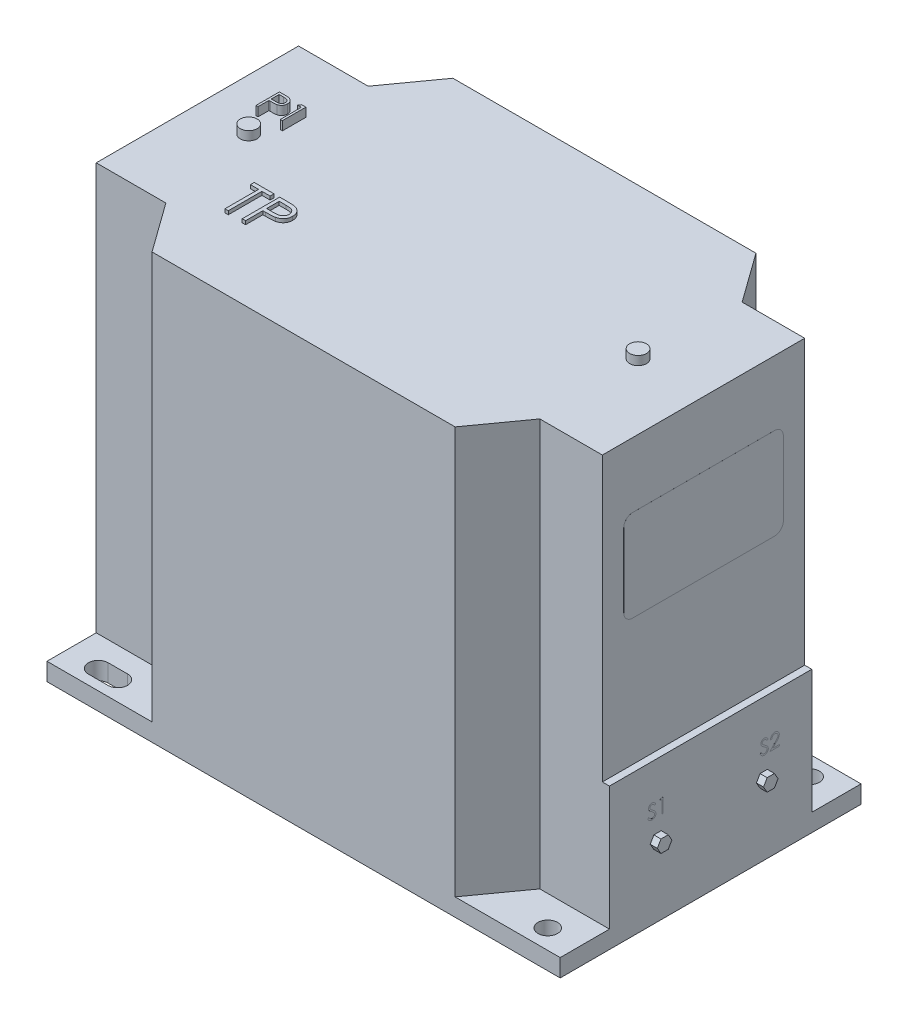
from build123d import *

# Parameters (mm, degrees)
CROQUIS1_W               = 290
CROQUIS1_H               = 170
SALIENTE_EXTRUIR1_DEPTH  = 240
CROQUIS2_R               = 5.5
CORTAR_EXTRUIR1_DEPTH    = 230
CROQUIS3_R               = 5.5
CORTAR_EXTRUIR3_DEPTH    = 309
CROQUIS4_W               = 114.318282822
CROQUIS4_H               = 160
CORTAR_EXTRUIR4_DEPTH    = 4
SALIENTE_EXTRUIR2_DEPTH  = 4
SALIENTE_EXTRUIR3_DEPTH  = 4
SALIENTE_EXTRUIR5_DEPTH  = 4
SALIENTE_EXTRUIR6_DEPTH  = 0.01
SALIENTE_EXTRUIR7_DEPTH  = 0.01
SALIENTE_EXTRUIR8_DEPTH  = 0.01
CROQUIS11_R              = 4.75
SALIENTE_EXTRUIR9_DEPTH  = 5
CROQUIS12_W              = 19.477537379
CROQUIS12_H              = 1.947753737
CROQUIS12_W_2            = 14.751875946
CROQUIS12_H_2            = 1.829107359
CROQUIS12_W_3            = 5.2253802
CROQUIS12_H_3            = 1.246064316
CROQUIS12_W_4            = 1.909821467
CROQUIS12_H_4            = 22.488415391
CROQUIS12_W_5            = 10.038203482
CROQUIS12_H_5            = 1.679080429
SALIENTE_EXTRUIR10_DEPTH = 0.1
SALIENTE_EXTRUIR11_DEPTH = 2


with BuildPart() as part:
    # Croquis1 → Saliente-Extruir1 (new body)
    with BuildSketch(Plane(origin=(0, 0, 0), x_dir=(1, 0, 0), z_dir=(0, 1, 0))):
        Rectangle(CROQUIS1_W, CROQUIS1_H)
    extrude(amount=SALIENTE_EXTRUIR1_DEPTH)

    # Croquis2 → Cortar-Extruir1 (cut)
    # profile 1 of 4: a face of its own
    with BuildSketch(Plane(origin=(0, 240, 0), x_dir=(1, 0, 0), z_dir=(0, 1, 0))):
        Polygon((-105.653068474, -57.159141411), (-145, -57.159141411), (-145, -85), (-85.626113794, -85), align=None)
        with BuildLine():
            Line((-116, -79.5), (-127, -79.5))
            ThreePointArc((-127, -79.5), (-132.5, -74), (-127, -68.5))
            Line((-127, -68.5), (-116, -68.5))
            ThreePointArc((-116, -68.5), (-110.5, -74), (-116, -79.5))
        make_face(mode=Mode.SUBTRACT)
    # profile 2 of 4: a face of its own
    with BuildSketch(Plane(origin=(0, 240, 0), x_dir=(1, 0, 0), z_dir=(0, 1, 0))):
        Polygon((-145, 85), (-145, 57.159141411), (-105.653068474, 57.159141411), (-85.626113794, 85), align=None)
        with BuildLine():
            ThreePointArc((-127, 68.5), (-132.5, 74), (-127, 79.5))
            Line((-127, 79.5), (-116, 79.5))
            ThreePointArc((-116, 79.5), (-110.5, 74), (-116, 68.5))
            Line((-116, 68.5), (-127, 68.5))
        make_face(mode=Mode.SUBTRACT)
    # profile 3 of 4: a face of its own
    with BuildSketch(Plane(origin=(0, 240, 0), x_dir=(1, 0, 0), z_dir=(0, 1, 0))):
        Polygon((145, 85), (85.626113794, 85), (105.653068474, 57.159141411), (145, 57.159141411), align=None)
        with Locations(Location((127, 74, 0), (0, 0, 270))):
            Circle(CROQUIS2_R, mode=Mode.SUBTRACT)
    # profile 4 of 4: a face of its own
    with BuildSketch(Plane(origin=(0, 240, 0), x_dir=(1, 0, 0), z_dir=(0, 1, 0))):
        Polygon((105.653068474, -57.159141411), (85.626113794, -85), (145, -85), (145, -57.159141411), align=None)
        with Locations(Location((127, -74, 0), (0, 0, 270))):
            Circle(CROQUIS2_R, mode=Mode.SUBTRACT)
    extrude(amount=-CORTAR_EXTRUIR1_DEPTH, mode=Mode.SUBTRACT)

    # Croquis3 → Cortar-Extruir3 (cut)
    with BuildSketch(Plane(origin=(0, 240, 0), x_dir=(1, 0, 0), z_dir=(0, 1, 0))):
        with Locations(Location((127, 74, 0), (0, 0, 270))):
            Circle(CROQUIS3_R)
        with Locations(Location((127, -74, 0), (0, 0, 270))):
            Circle(CROQUIS3_R)
        with BuildLine():
            Line((-127, 79.5), (-116, 79.5))
            ThreePointArc((-116, 79.5), (-110.5, 74), (-116, 68.5))
            Line((-116, 68.5), (-127, 68.5))
            ThreePointArc((-127, 68.5), (-132.5, 74), (-127, 79.5))
        make_face()
        with BuildLine():
            Line((-127, -68.426195021), (-116, -68.426195021))
            ThreePointArc((-116, -68.426195021), (-110.426195021, -74), (-116, -79.573804979))
            Line((-116, -79.573804979), (-127, -79.573804979))
            ThreePointArc((-127, -79.573804979), (-132.573804979, -74), (-127, -68.426195021))
        make_face()
    extrude(amount=-CORTAR_EXTRUIR3_DEPTH, mode=Mode.SUBTRACT)

    # Croquis4 → Cortar-Extruir4 (cut)
    with BuildSketch(Plane(origin=(145, 0, 0), x_dir=(0, 0, -1), z_dir=(1, 0, 0))):
        with Locations((0, 160)):
            Rectangle(CROQUIS4_W, CROQUIS4_H)
    extrude(amount=-CORTAR_EXTRUIR4_DEPTH, mode=Mode.SUBTRACT)

    # Croquis5 → Saliente-Extruir2 (add)
    with BuildSketch(Plane.ZY.offset(145)):
        Polygon((43.413866741, 29.419642397), (40.989340839, 33.619044445), (36.140289034, 33.619044445), (33.715763131, 29.419642397), (36.140289034, 25.220240349), (40.989340839, 25.220240349), align=None)
    extrude(amount=SALIENTE_EXTRUIR2_DEPTH)

    # Croquis6 → Saliente-Extruir3 (add)
    with BuildSketch(Plane.ZY.offset(145)):
        Polygon((43.413866741, 74.385865647), (40.989340839, 78.585267695), (36.140289034, 78.585267695), (33.715763131, 74.385865647), (36.140289034, 70.186463599), (40.989340839, 70.186463599), align=None)
    extrude(amount=SALIENTE_EXTRUIR3_DEPTH)

    # Croquis7 → Saliente-Extruir5 (add)
    with BuildSketch(Plane(origin=(145, 0, 0), x_dir=(0, 0, -1), z_dir=(1, 0, 0))):
        Polygon((-27.944874359, 36.440417974), (-32.055125641, 36.440417974), (-34.110251282, 40), (-32.055125641, 43.559582026), (-27.944874359, 43.559582026), (-25.889748718, 40), align=None)
        Polygon((34.110251282, 40), (32.055125641, 43.559582026), (27.944874359, 43.559582026), (25.889748718, 40), (27.944874359, 36.440417974), (32.055125641, 36.440417974), align=None)
    extrude(amount=SALIENTE_EXTRUIR5_DEPTH)

    # Croquis8 → Saliente-Extruir6 (add)
    with BuildSketch(Plane(origin=(145, 0, 0), x_dir=(0, 0, -1), z_dir=(1, 0, 0))):
        with BuildLine():
            Line((-35.585423462, 53.072879107), (-34.914424864, 53.475160256))
            add(Edge.make_bspline(
                [(-34.914424864, 53.475160256), (-34.852017433, 53.370692812), (-34.732447204, 53.17053722), (-34.532986086, 52.900077021), (-34.326309663, 52.67020213), (-34.110887424, 52.482249823), (-33.888034292, 52.33427467), (-33.656295455, 52.229494608), (-33.416451849, 52.164144093), (-33.253225504, 52.156206397), (-33.171736563, 52.15224359)],
                knots=[0, 0, 0, 0, 1.272034388, 2.437168799, 3.508375237, 4.49857839, 5.41946034, 6.295179144, 7.148887113, 8, 8, 8, 8], degree=3))
            add(Edge.make_bspline(
                [(-33.171736563, 52.15224359), (-33.102143147, 52.154181865), (-32.964174037, 52.1580245), (-32.761059665, 52.194947033), (-32.563797363, 52.251670968), (-32.376452774, 52.332907724), (-32.201610934, 52.431193218), (-32.048288607, 52.549906871), (-31.915741172, 52.682817373), (-31.80731693, 52.831095893), (-31.72413185, 52.990565141), (-31.660196266, 53.154249888), (-31.624715474, 53.324721462), (-31.619370694, 53.439498762), (-31.616673462, 53.497420873)],
                knots=[0, 0, 0, 0, 1.095163259, 2.171163733, 3.241058638, 4.321873601, 5.38011039, 6.391990106, 7.366004449, 8.327778327, 9.272591725, 10.192022065, 11.087607919, 12, 12, 12, 12], degree=3))
            add(Edge.make_bspline(
                [(-31.616673462, 53.497420873), (-31.620016988, 53.563508158), (-31.626813888, 53.697853949), (-31.684262066, 53.896063876), (-31.774634465, 54.092216669), (-31.858006889, 54.213549896), (-31.901291351, 54.276542468)],
                knots=[0, 0, 0, 0, 0.938893495, 1.908633276, 2.914225137, 4, 4, 4, 4], degree=3))
            add(Edge.make_bspline(
                [(-31.901291351, 54.276542468), (-31.936830065, 54.3220058), (-32.01143915, 54.417450379), (-32.139703509, 54.559520824), (-32.290212376, 54.706066167), (-32.45781508, 54.862682242), (-32.648616907, 55.022084924), (-32.856641806, 55.191875483), (-33.087200914, 55.365596917), (-33.248897987, 55.482102556), (-33.332331014, 55.542217548)],
                knots=[0, 0, 0, 0, 0.722233717, 1.516239348, 2.393582979, 3.351407094, 4.387010283, 5.505090956, 6.712668013, 8, 8, 8, 8], degree=3))
            add(Edge.make_bspline(
                [(-33.332331014, 55.542217548), (-33.415842577, 55.601700238), (-33.575510326, 55.715426611), (-33.798800325, 55.884210255), (-33.998472589, 56.038524031), (-34.173639645, 56.17982063), (-34.324224445, 56.308119215), (-34.451413609, 56.422187756), (-34.551967122, 56.525111189), (-34.607882457, 56.591879946), (-34.632987064, 56.621857472)],
                knots=[0, 0, 0, 0, 1.452282411, 2.77665338, 3.964542531, 5.026858415, 5.96415736, 6.766646006, 7.446254459, 8, 8, 8, 8], degree=3))
            add(Edge.make_bspline(
                [(-34.632987064, 56.621857472), (-34.668076586, 56.668577681), (-34.737084841, 56.760459241), (-34.828175603, 56.904070972), (-34.905598347, 57.051080877), (-34.966291493, 57.201883999), (-35.017400418, 57.354363212), (-35.05177644, 57.510508002), (-35.073301572, 57.669617726), (-35.075505899, 57.7766912), (-35.07660936, 57.830290966)],
                knots=[0, 0, 0, 0, 1.068054152, 2.10047183, 3.106115577, 4.101338837, 5.06977816, 6.043150881, 7.020423561, 8, 8, 8, 8], degree=3))
            add(Edge.make_bspline(
                [(-35.07660936, 57.830290966), (-35.073649332, 57.914269204), (-35.067792545, 58.080430706), (-35.018261372, 58.323161339), (-34.940081774, 58.554905535), (-34.830555868, 58.773368971), (-34.689365085, 58.972863249), (-34.525975108, 59.155683121), (-34.331366916, 59.309372584), (-34.117842217, 59.443657074), (-33.884125087, 59.548763012), (-33.639217145, 59.62804952), (-33.382729143, 59.672974087), (-33.209004177, 59.679421071), (-33.120855153, 59.682692308)],
                knots=[0, 0, 0, 0, 1.005424448, 1.989358655, 2.955360095, 3.929531133, 4.905563448, 5.876582895, 6.856512386, 7.866279853, 8.892233794, 9.918561126, 10.94386622, 12, 12, 12, 12], degree=3))
            add(Edge.make_bspline(
                [(-33.120855153, 59.682692308), (-33.027319425, 59.679466164), (-32.841306717, 59.673050394), (-32.567691532, 59.617266706), (-32.304255621, 59.524963397), (-32.092339646, 59.420214119), (-31.92648499, 59.315594659), (-31.8000004, 59.2202997), (-31.671826896, 59.110591864), (-31.540930593, 58.986178931), (-31.409529454, 58.845919335), (-31.275672696, 58.690773666), (-31.139047301, 58.521690048), (-31.051154547, 58.400984484), (-31.006096539, 58.339105068)],
                knots=[0, 0, 0, 0, 1.286793592, 2.559021753, 3.825965368, 5.121522368, 5.803751409, 6.523245864, 7.299691795, 8.125521123, 9.008227632, 9.944561021, 10.946284179, 12, 12, 12, 12], degree=3))
            Line((-31.006096539, 58.339105068), (-31.650064388, 57.850961538))
            add(Edge.make_bspline(
                [(-31.650064388, 57.850961538), (-31.688948913, 57.901055533), (-31.763831417, 57.997524854), (-31.877517932, 58.132624087), (-31.984671116, 58.256032889), (-32.090240773, 58.363223447), (-32.18865133, 58.460065785), (-32.284166765, 58.542978091), (-32.375412526, 58.612772745), (-32.490431234, 58.687257247), (-32.634933916, 58.761090746), (-32.816327418, 58.823568119), (-33.005889149, 58.861112635), (-33.13499742, 58.866076719), (-33.200357356, 58.868589744)],
                knots=[0, 0, 0, 0, 1.181633172, 2.275549214, 3.290209073, 4.226197932, 5.078386478, 5.862611352, 6.581680152, 7.217281963, 8.414376989, 9.595101626, 10.782541182, 12, 12, 12, 12], degree=3))
            add(Edge.make_bspline(
                [(-33.200357356, 58.868589744), (-33.282355184, 58.865841781), (-33.44048027, 58.860542595), (-33.664975984, 58.802666914), (-33.867028278, 58.711540195), (-34.04063856, 58.583825869), (-34.185184919, 58.43251219), (-34.289745513, 58.258388715), (-34.352678921, 58.066114337), (-34.36035852, 57.93198951), (-34.364269616, 57.863681891)],
                knots=[0, 0, 0, 0, 1.14458467, 2.207223713, 3.21896685, 4.227309161, 5.202851033, 6.127160689, 7.046193047, 8, 8, 8, 8], degree=3))
            add(Edge.make_bspline(
                [(-34.364269616, 57.863681891), (-34.363378061, 57.821156216), (-34.361593493, 57.73603533), (-34.33670422, 57.610279426), (-34.304728956, 57.48484121), (-34.254059059, 57.360284638), (-34.184106317, 57.23443136), (-34.092246364, 57.105114205), (-33.97655546, 56.971193366), (-33.887934378, 56.884090929), (-33.841145117, 56.838103466)],
                knots=[0, 0, 0, 0, 0.858281714, 1.717966888, 2.583508476, 3.4729293, 4.427298488, 5.488583878, 6.674047936, 8, 8, 8, 8], degree=3))
            add(Edge.make_bspline(
                [(-33.841145117, 56.838103466), (-33.823770219, 56.822598068), (-33.782491438, 56.785760792), (-33.707026392, 56.725453298), (-33.607370403, 56.651061297), (-33.486125768, 56.559015061), (-33.34105693, 56.452241031), (-33.172147937, 56.332104446), (-32.981281603, 56.19470528), (-32.84584083, 56.098644429), (-32.774225545, 56.047851563)],
                knots=[0, 0, 0, 0, 0.420754252, 0.999615792, 1.744751191, 2.668019286, 3.750313428, 4.999500688, 6.413464383, 8, 8, 8, 8], degree=3))
            add(Edge.make_bspline(
                [(-32.774225545, 56.047851563), (-32.688078921, 55.985164908), (-32.521267921, 55.863780889), (-32.283919481, 55.681409615), (-32.068713881, 55.503047711), (-31.874895544, 55.329834209), (-31.700549698, 55.163082998), (-31.547610582, 55.000787929), (-31.414519842, 54.844111719), (-31.2712384, 54.643241771), (-31.124830488, 54.396541812), (-30.99909707, 54.094285807), (-30.919816532, 53.790854865), (-30.909448988, 53.586913647), (-30.904333719, 53.486290565)],
                knots=[0, 0, 0, 0, 1.163667725, 2.253281268, 3.268753668, 4.215851969, 5.092017293, 5.902905408, 6.650798638, 7.335211899, 8.59617414, 9.77448103, 10.901945474, 12, 12, 12, 12], degree=3))
            add(Edge.make_bspline(
                [(-30.904333719, 53.486290565), (-30.905824014, 53.415128915), (-30.908775664, 53.274187528), (-30.942704879, 53.06723405), (-30.992415549, 52.866231899), (-31.067339276, 52.673665626), (-31.158786438, 52.486012325), (-31.274824179, 52.308194408), (-31.409325535, 52.136276326), (-31.563616395, 51.974842336), (-31.732449066, 51.826646499), (-31.910892445, 51.694818092), (-32.0992386, 51.584898858), (-32.296465782, 51.495203199), (-32.502619296, 51.4250504), (-32.717629806, 51.374221215), (-32.941851733, 51.343025227), (-33.094252825, 51.339787268), (-33.171736563, 51.338141026)],
                knots=[0, 0, 0, 0, 0.983748083, 1.948392443, 2.894712957, 3.844097841, 4.80183111, 5.778335162, 6.776009319, 7.81870978, 8.863265674, 9.881300176, 10.883814829, 11.87499822, 12.874611388, 13.892143829, 14.928324115, 16, 16, 16, 16], degree=3))
            add(Edge.make_bspline(
                [(-33.171736563, 51.338141026), (-33.231688144, 51.339300312), (-33.350836279, 51.341604286), (-33.527070282, 51.361972547), (-33.699743994, 51.390790443), (-33.866690669, 51.436542351), (-34.030061227, 51.492052639), (-34.189145134, 51.560402072), (-34.344019489, 51.642310725), (-34.495552221, 51.735961941), (-34.643357939, 51.844950041), (-34.786050303, 51.971889934), (-34.928311135, 52.113280633), (-35.06594148, 52.272961732), (-35.201725218, 52.448353456), (-35.332985182, 52.641096782), (-35.462438364, 52.850141853), (-35.543662728, 52.997246601), (-35.585423462, 53.072879107)],
                knots=[0, 0, 0, 0, 0.915332311, 1.819136955, 2.706846663, 3.586547465, 4.459518054, 5.340707479, 6.227863349, 7.133153174, 8.059268498, 9.028702269, 10.047606654, 11.120612155, 12.245963614, 13.433783089, 14.680604001, 16, 16, 16, 16], degree=3))
        make_face()
        Polygon((-28.301431575, 59.479166667), (-26.833820898, 59.479166667), (-26.833820898, 51.541666667), (-27.546160642, 51.541666667), (-27.546160642, 58.665064103), (-28.767314488, 58.665064103), align=None)
        with BuildLine():
            Line((27.914576538, 53.072879107), (28.585575136, 53.475160256))
            add(Edge.make_bspline(
                [(28.585575136, 53.475160256), (28.647982567, 53.370692812), (28.767552796, 53.17053722), (28.967013914, 52.900077021), (29.173690337, 52.67020213), (29.389112576, 52.482249823), (29.611965708, 52.33427467), (29.843704545, 52.229494608), (30.083548151, 52.164144093), (30.246774496, 52.156206397), (30.328263437, 52.15224359)],
                knots=[0, 0, 0, 0, 1.272034388, 2.437168799, 3.508375237, 4.49857839, 5.41946034, 6.295179144, 7.148887113, 8, 8, 8, 8], degree=3))
            add(Edge.make_bspline(
                [(30.328263437, 52.15224359), (30.397856853, 52.154181865), (30.535825963, 52.1580245), (30.738940335, 52.194947033), (30.936202637, 52.251670968), (31.123547226, 52.332907724), (31.298389066, 52.431193218), (31.451711393, 52.549906871), (31.584258828, 52.682817373), (31.69268307, 52.831095893), (31.77586815, 52.990565141), (31.839803734, 53.154249888), (31.875284526, 53.324721462), (31.880629306, 53.439498762), (31.883326538, 53.497420873)],
                knots=[0, 0, 0, 0, 1.095163259, 2.171163733, 3.241058638, 4.321873601, 5.38011039, 6.391990106, 7.366004449, 8.327778327, 9.272591725, 10.192022065, 11.087607919, 12, 12, 12, 12], degree=3))
            add(Edge.make_bspline(
                [(31.883326538, 53.497420873), (31.879983012, 53.563508158), (31.873186112, 53.697853949), (31.815737934, 53.896063876), (31.725365535, 54.092216669), (31.641993111, 54.213549896), (31.598708649, 54.276542468)],
                knots=[0, 0, 0, 0, 0.938893495, 1.908633276, 2.914225137, 4, 4, 4, 4], degree=3))
            add(Edge.make_bspline(
                [(31.598708649, 54.276542468), (31.563169935, 54.3220058), (31.48856085, 54.417450379), (31.360296491, 54.559520824), (31.209787624, 54.706066167), (31.04218492, 54.862682242), (30.851383093, 55.022084924), (30.643358194, 55.191875483), (30.412799086, 55.365596917), (30.251102013, 55.482102556), (30.167668986, 55.542217548)],
                knots=[0, 0, 0, 0, 0.722233717, 1.516239348, 2.393582979, 3.351407094, 4.387010283, 5.505090956, 6.712668013, 8, 8, 8, 8], degree=3))
            add(Edge.make_bspline(
                [(30.167668986, 55.542217548), (30.084157423, 55.601700238), (29.924489674, 55.715426611), (29.701199675, 55.884210255), (29.501527411, 56.038524031), (29.326360355, 56.17982063), (29.175775555, 56.308119215), (29.048586391, 56.422187756), (28.948032878, 56.525111189), (28.892117543, 56.591879946), (28.867012936, 56.621857472)],
                knots=[0, 0, 0, 0, 1.452282411, 2.77665338, 3.964542531, 5.026858415, 5.96415736, 6.766646006, 7.446254459, 8, 8, 8, 8], degree=3))
            add(Edge.make_bspline(
                [(28.867012936, 56.621857472), (28.831923414, 56.668577681), (28.762915159, 56.760459241), (28.671824397, 56.904070972), (28.594401653, 57.051080877), (28.533708507, 57.201883999), (28.482599582, 57.354363212), (28.44822356, 57.510508002), (28.426698428, 57.669617726), (28.424494101, 57.7766912), (28.42339064, 57.830290966)],
                knots=[0, 0, 0, 0, 1.068054152, 2.10047183, 3.106115577, 4.101338837, 5.06977816, 6.043150881, 7.020423561, 8, 8, 8, 8], degree=3))
            add(Edge.make_bspline(
                [(28.42339064, 57.830290966), (28.426350668, 57.914269204), (28.432207455, 58.080430706), (28.481738628, 58.323161339), (28.559918226, 58.554905535), (28.669444132, 58.773368971), (28.810634915, 58.972863249), (28.974024892, 59.155683121), (29.168633084, 59.309372584), (29.382157783, 59.443657074), (29.615874913, 59.548763012), (29.860782855, 59.62804952), (30.117270857, 59.672974087), (30.290995823, 59.679421071), (30.379144847, 59.682692308)],
                knots=[0, 0, 0, 0, 1.005424448, 1.989358655, 2.955360095, 3.929531133, 4.905563448, 5.876582895, 6.856512386, 7.866279853, 8.892233794, 9.918561126, 10.94386622, 12, 12, 12, 12], degree=3))
            add(Edge.make_bspline(
                [(30.379144847, 59.682692308), (30.472680575, 59.679466164), (30.658693283, 59.673050394), (30.932308468, 59.617266706), (31.195744379, 59.524963397), (31.407660354, 59.420214119), (31.57351501, 59.315594659), (31.6999996, 59.2202997), (31.828173104, 59.110591864), (31.959069407, 58.986178931), (32.090470546, 58.845919335), (32.224327304, 58.690773666), (32.360952699, 58.521690048), (32.448845453, 58.400984484), (32.493903461, 58.339105068)],
                knots=[0, 0, 0, 0, 1.286793592, 2.559021753, 3.825965368, 5.121522368, 5.803751409, 6.523245864, 7.299691795, 8.125521123, 9.008227632, 9.944561021, 10.946284179, 12, 12, 12, 12], degree=3))
            Line((32.493903461, 58.339105068), (31.849935612, 57.850961538))
            add(Edge.make_bspline(
                [(31.849935612, 57.850961538), (31.811051087, 57.901055533), (31.736168583, 57.997524854), (31.622482068, 58.132624087), (31.515328884, 58.256032889), (31.409759227, 58.363223447), (31.31134867, 58.460065785), (31.215833235, 58.542978091), (31.124587474, 58.612772745), (31.009568766, 58.687257247), (30.865066084, 58.761090746), (30.683672582, 58.823568119), (30.494110851, 58.861112635), (30.36500258, 58.866076719), (30.299642644, 58.868589744)],
                knots=[0, 0, 0, 0, 1.181633172, 2.275549214, 3.290209073, 4.226197932, 5.078386478, 5.862611352, 6.581680152, 7.217281963, 8.414376989, 9.595101626, 10.782541182, 12, 12, 12, 12], degree=3))
            add(Edge.make_bspline(
                [(30.299642644, 58.868589744), (30.217644816, 58.865841781), (30.05951973, 58.860542595), (29.835024016, 58.802666914), (29.632971722, 58.711540195), (29.45936144, 58.583825869), (29.314815081, 58.43251219), (29.210254487, 58.258388715), (29.147321079, 58.066114337), (29.13964148, 57.93198951), (29.135730384, 57.863681891)],
                knots=[0, 0, 0, 0, 1.14458467, 2.207223713, 3.21896685, 4.227309161, 5.202851033, 6.127160689, 7.046193047, 8, 8, 8, 8], degree=3))
            add(Edge.make_bspline(
                [(29.135730384, 57.863681891), (29.136621939, 57.821156216), (29.138406507, 57.73603533), (29.16329578, 57.610279426), (29.195271044, 57.48484121), (29.245940941, 57.360284638), (29.315893683, 57.23443136), (29.407753636, 57.105114205), (29.52344454, 56.971193366), (29.612065622, 56.884090929), (29.658854883, 56.838103466)],
                knots=[0, 0, 0, 0, 0.858281714, 1.717966888, 2.583508476, 3.4729293, 4.427298488, 5.488583878, 6.674047936, 8, 8, 8, 8], degree=3))
            add(Edge.make_bspline(
                [(29.658854883, 56.838103466), (29.676229781, 56.822598068), (29.717508562, 56.785760792), (29.792973608, 56.725453298), (29.892629597, 56.651061297), (30.013874232, 56.559015061), (30.15894307, 56.452241031), (30.327852063, 56.332104446), (30.518718397, 56.19470528), (30.65415917, 56.098644429), (30.725774455, 56.047851563)],
                knots=[0, 0, 0, 0, 0.420754252, 0.999615792, 1.744751191, 2.668019286, 3.750313428, 4.999500688, 6.413464383, 8, 8, 8, 8], degree=3))
            add(Edge.make_bspline(
                [(30.725774455, 56.047851563), (30.811921079, 55.985164908), (30.978732079, 55.863780889), (31.216080519, 55.681409615), (31.431286119, 55.503047711), (31.625104456, 55.329834209), (31.799450302, 55.163082998), (31.952389418, 55.000787929), (32.085480158, 54.844111719), (32.2287616, 54.643241771), (32.375169512, 54.396541812), (32.50090293, 54.094285807), (32.580183468, 53.790854865), (32.590551012, 53.586913647), (32.595666281, 53.486290565)],
                knots=[0, 0, 0, 0, 1.163667725, 2.253281268, 3.268753668, 4.215851969, 5.092017293, 5.902905408, 6.650798638, 7.335211899, 8.59617414, 9.77448103, 10.901945474, 12, 12, 12, 12], degree=3))
            add(Edge.make_bspline(
                [(32.595666281, 53.486290565), (32.594175986, 53.415128915), (32.591224336, 53.274187528), (32.557295121, 53.06723405), (32.507584451, 52.866231899), (32.432660724, 52.673665626), (32.341213562, 52.486012325), (32.225175821, 52.308194408), (32.090674465, 52.136276326), (31.936383605, 51.974842336), (31.767550934, 51.826646499), (31.589107555, 51.694818092), (31.4007614, 51.584898858), (31.203534218, 51.495203199), (30.997380704, 51.4250504), (30.782370194, 51.374221215), (30.558148267, 51.343025227), (30.405747175, 51.339787268), (30.328263437, 51.338141026)],
                knots=[0, 0, 0, 0, 0.983748083, 1.948392443, 2.894712957, 3.844097841, 4.80183111, 5.778335162, 6.776009319, 7.81870978, 8.863265674, 9.881300176, 10.883814829, 11.87499822, 12.874611388, 13.892143829, 14.928324115, 16, 16, 16, 16], degree=3))
            add(Edge.make_bspline(
                [(30.328263437, 51.338141026), (30.268311856, 51.339300312), (30.149163721, 51.341604286), (29.972929718, 51.361972547), (29.800256006, 51.390790443), (29.633309331, 51.436542351), (29.469938773, 51.492052639), (29.310854866, 51.560402072), (29.155980511, 51.642310725), (29.004447779, 51.735961941), (28.856642061, 51.844950041), (28.713949697, 51.971889934), (28.571688865, 52.113280633), (28.43405852, 52.272961732), (28.298274782, 52.448353456), (28.167014818, 52.641096782), (28.037561636, 52.850141853), (27.956337272, 52.997246601), (27.914576538, 53.072879107)],
                knots=[0, 0, 0, 0, 0.915332311, 1.819136955, 2.706846663, 3.586547465, 4.459518054, 5.340707479, 6.227863349, 7.133153174, 8.059268498, 9.028702269, 10.047606654, 11.120612155, 12.245963614, 13.433783089, 14.680604001, 16, 16, 16, 16], degree=3))
        make_face()
        with BuildLine():
            Line((34.529159871, 57.036858974), (33.816820128, 57.036858974))
            add(Edge.make_bspline(
                [(33.816820128, 57.036858974), (33.821462778, 57.131362595), (33.83058082, 57.31696519), (33.873280691, 57.587574764), (33.934378751, 57.846234754), (34.020764728, 58.090868309), (34.128048607, 58.323638461), (34.256704205, 58.543620639), (34.409090259, 58.749975657), (34.581916245, 58.940790533), (34.769623695, 59.115840917), (34.972156807, 59.267005486), (35.184983923, 59.394725919), (35.407459345, 59.501499449), (35.642093123, 59.581645171), (35.886756033, 59.641112104), (36.142523003, 59.676890602), (36.316785196, 59.680736402), (36.405411874, 59.682692308)],
                knots=[0, 0, 0, 0, 1.10065271, 2.161652631, 3.183658789, 4.190468796, 5.17591951, 6.163126047, 7.15150782, 8.156236427, 9.156009102, 10.134482811, 11.092018607, 12.041330605, 13.001268258, 13.972401359, 14.968799086, 16, 16, 16, 16], degree=3))
            add(Edge.make_bspline(
                [(36.405411874, 59.682692308), (36.492447864, 59.680654737), (36.663470474, 59.676650983), (36.9130754, 59.642267934), (37.150695335, 59.588416325), (37.375865806, 59.51286172), (37.586790274, 59.411297036), (37.78505325, 59.289291904), (37.973015089, 59.148186215), (38.142212616, 58.982057031), (38.297579153, 58.804705195), (38.431614624, 58.615366556), (38.546398048, 58.419810855), (38.642073679, 58.216546897), (38.712504566, 58.003660815), (38.765976573, 57.78425198), (38.796201244, 57.556049284), (38.800839972, 57.401593345), (38.803198333, 57.323066907)],
                knots=[0, 0, 0, 0, 1.111607364, 2.184268762, 3.212621178, 4.221274766, 5.211760367, 6.196651075, 7.1921475, 8.207485113, 9.220403448, 10.201281604, 11.166441695, 12.114753415, 13.065576456, 14.026450734, 14.996634279, 16, 16, 16, 16], degree=3))
            add(Edge.make_bspline(
                [(38.803198333, 57.323066907), (38.799358255, 57.212513782), (38.791745486, 56.993347583), (38.726625382, 56.671278162), (38.624919901, 56.359235944), (38.50246161, 56.108099563), (38.378925889, 55.905730746), (38.267602434, 55.739114219), (38.137280452, 55.559714318), (37.986063144, 55.368131785), (37.817078595, 55.162865982), (37.628796188, 54.94404091), (37.419873292, 54.713917432), (37.273237049, 54.556742229), (37.197253822, 54.475297977)],
                knots=[0, 0, 0, 0, 1.184426356, 2.348067706, 3.509069118, 4.696110526, 5.333549288, 6.050745305, 6.844228056, 7.710549037, 8.667450064, 9.695053472, 10.805634456, 12, 12, 12, 12], degree=3))
            Line((37.197253822, 54.475297977), (35.211288777, 52.355769231))
            Line((35.211288777, 52.355769231), (38.904961153, 52.355769231))
            Line((38.904961153, 52.355769231), (38.904961153, 51.541666667))
            Line((38.904961153, 51.541666667), (33.511531666, 51.541666667))
            Line((33.511531666, 51.541666667), (36.589856987, 54.826697716))
            add(Edge.make_bspline(
                [(36.589856987, 54.826697716), (36.664804873, 54.904934947), (36.808764424, 55.055212656), (37.012378482, 55.274611869), (37.195256187, 55.478151006), (37.358581346, 55.6654455), (37.498810903, 55.839234949), (37.623253286, 55.993890794), (37.722960965, 56.136208923), (37.831172666, 56.301174243), (37.935979374, 56.502587891), (38.026041325, 56.748726794), (38.080957142, 57.002108242), (38.087544893, 57.173336076), (38.090858589, 57.259465144)],
                knots=[0, 0, 0, 0, 1.329631726, 2.553950428, 3.673215718, 4.687767853, 5.603093632, 6.413772471, 7.123043292, 7.734684054, 8.834405432, 9.900288307, 10.943827018, 12, 12, 12, 12], degree=3))
            add(Edge.make_bspline(
                [(38.090858589, 57.259465144), (38.089416816, 57.313624744), (38.086575359, 57.420362916), (38.061498081, 57.576858119), (38.02360104, 57.727817608), (37.969296616, 57.873705726), (37.897617045, 58.013055687), (37.810364915, 58.146037115), (37.709694593, 58.27459959), (37.59323725, 58.395143676), (37.465303982, 58.505545696), (37.330152737, 58.603344961), (37.187164108, 58.685076516), (37.036940974, 58.752076947), (36.879902141, 58.804635401), (36.71574388, 58.841053965), (36.544919772, 58.863919598), (36.428275951, 58.867013345), (36.368840861, 58.868589744)],
                knots=[0, 0, 0, 0, 0.991446411, 1.95395049, 2.89581595, 3.838931463, 4.798493298, 5.75982156, 6.748411868, 7.785213223, 8.824556874, 9.840280684, 10.836137867, 11.835679398, 12.848801643, 13.863922112, 14.911575587, 16, 16, 16, 16], degree=3))
            add(Edge.make_bspline(
                [(36.368840861, 58.868589744), (36.306767722, 58.866968153), (36.184866327, 58.863783616), (36.005889235, 58.841507217), (35.835151846, 58.803076472), (35.672224674, 58.750515085), (35.516832041, 58.683707305), (35.369729656, 58.600495669), (35.231247746, 58.501200962), (35.101125988, 58.388623272), (34.981238036, 58.263284247), (34.875903156, 58.123561653), (34.78386441, 57.972006621), (34.703561327, 57.809028087), (34.63834753, 57.633147193), (34.588515564, 57.444988291), (34.549084679, 57.245368372), (34.535911784, 57.107516483), (34.529159871, 57.036858974)],
                knots=[0, 0, 0, 0, 1.031018746, 2.02475058, 2.990194455, 3.934040569, 4.864654155, 5.795059489, 6.735614925, 7.690564532, 8.649604399, 9.611025574, 10.590972636, 11.591080095, 12.624614302, 13.701020113, 14.821632451, 16, 16, 16, 16], degree=3))
        make_face()
    extrude(amount=SALIENTE_EXTRUIR6_DEPTH)

    # Croquis9 → Saliente-Extruir7 (add)
    # profile 1 of 2: a face of its own
    with BuildSketch(Plane.ZY.offset(145)):
        with BuildLine():
            Line((31.885683761, 114.9375), (34.480105669, 114.9375))
            add(Edge.make_bspline(
                [(34.480105669, 114.9375), (34.658551654, 114.937303845), (35.000462085, 114.936928002), (35.490754111, 114.925532981), (35.936046846, 114.910313043), (36.335380131, 114.889214816), (36.689982645, 114.864281275), (36.998249819, 114.829310769), (37.26260469, 114.792797152), (37.421001091, 114.755674574), (37.493239183, 114.738744491)],
                knots=[0, 0, 0, 0, 1.415646017, 2.712440637, 3.8905458, 4.950247383, 5.884950622, 6.709939814, 7.411656543, 8, 8, 8, 8], degree=3))
            add(Edge.make_bspline(
                [(37.493239183, 114.738744491), (37.58468498, 114.713715097), (37.765421769, 114.664246096), (38.025851307, 114.565164463), (38.273629235, 114.447681279), (38.509605661, 114.313787221), (38.730880796, 114.157737618), (38.940756011, 113.98585817), (39.137379151, 113.794180515), (39.319644531, 113.584854504), (39.487030521, 113.361394187), (39.631151644, 113.120463735), (39.75182896, 112.86611863), (39.855331206, 112.598535786), (39.929824472, 112.315468195), (39.985942218, 112.018882704), (40.021561286, 111.708811107), (40.024972755, 111.496918156), (40.026709402, 111.389051649)],
                knots=[0, 0, 0, 0, 0.999701418, 1.975846123, 2.934577507, 3.890451536, 4.834027766, 5.787354733, 6.749476667, 7.726910423, 8.712836071, 9.690891519, 10.682875813, 11.679750201, 12.712814741, 13.765529915, 14.8625177, 16, 16, 16, 16], degree=3))
            add(Edge.make_bspline(
                [(40.026709402, 111.389051649), (40.025116517, 111.280278505), (40.021999929, 111.067456501), (39.984594327, 110.756106975), (39.934209376, 110.458570202), (39.856735399, 110.17550591), (39.755265146, 109.908595111), (39.636232685, 109.653758907), (39.492663984, 109.415332766), (39.327696919, 109.192451102), (39.144183452, 108.984904707), (38.942900025, 108.794197597), (38.724659247, 108.621446079), (38.490154699, 108.466262876), (38.237100211, 108.332246581), (37.969333738, 108.21221153), (37.68452786, 108.111401271), (37.487441572, 108.058370979), (37.387236245, 108.031408587)],
                knots=[0, 0, 0, 0, 1.121902311, 2.195077645, 3.232258892, 4.234102512, 5.217864754, 6.176164875, 7.132989551, 8.084763148, 9.034132444, 9.988522005, 10.94243251, 11.903244335, 12.886203696, 13.894208494, 14.929344452, 16, 16, 16, 16], degree=3))
            add(Edge.make_bspline(
                [(37.387236245, 108.031408587), (37.304356143, 108.013783629), (37.122719581, 107.975157508), (36.823578935, 107.932036258), (36.475291315, 107.895230445), (36.078332103, 107.867633884), (35.633057611, 107.844008979), (35.139226966, 107.825230767), (34.595870781, 107.81491257), (34.216869353, 107.814380406), (34.018992889, 107.814102564)],
                knots=[0, 0, 0, 0, 0.601384939, 1.31797006, 2.144135048, 3.087295005, 4.142315834, 5.309527816, 6.595305764, 8, 8, 8, 8], degree=3))
            Line((34.018992889, 107.814102564), (33.072916667, 107.814102564))
            Line((33.072916667, 107.814102564), (33.072916667, 101.708333333))
            Line((33.072916667, 101.708333333), (31.885683761, 101.708333333))
            Line((31.885683761, 101.708333333), (31.885683761, 114.9375))
        make_face()
        with BuildLine():
            Line((33.072916667, 113.580662393), (33.072916667, 109.170940171))
            Line((33.072916667, 109.170940171), (35.389080863, 109.141789363))
            add(Edge.make_bspline(
                [(35.389080863, 109.141789363), (35.502171058, 109.141730914), (35.72048935, 109.14161808), (36.035858408, 109.156681276), (36.328447083, 109.174070194), (36.597356639, 109.199530381), (36.842708296, 109.235518468), (37.064911158, 109.271848548), (37.262242257, 109.324407508), (37.493182692, 109.395176252), (37.750521536, 109.515873936), (38.030479234, 109.691065485), (38.267737105, 109.914376495), (38.473047334, 110.165457881), (38.635977289, 110.444778995), (38.755251427, 110.74364075), (38.825332587, 111.058978157), (38.834729807, 111.27475773), (38.839476496, 111.383751502)],
                knots=[0, 0, 0, 0, 1.160613943, 2.240541288, 3.23993089, 4.169200891, 5.011653406, 5.7853311, 6.478053781, 7.106038997, 8.262395093, 9.384106736, 10.481365981, 11.59014053, 12.70357646, 13.786202915, 14.881775077, 16, 16, 16, 16], degree=3))
            add(Edge.make_bspline(
                [(38.839476496, 111.383751502), (38.834703993, 111.490108384), (38.825216847, 111.7015327), (38.754702126, 112.011392896), (38.636209184, 112.307105231), (38.471953603, 112.58292612), (38.27260469, 112.833104039), (38.040907768, 113.05042949), (37.777408238, 113.225136521), (37.532297365, 113.337899222), (37.314578596, 113.406748627), (37.1254697, 113.454921089), (36.911948401, 113.493382458), (36.673945187, 113.524525817), (36.413304773, 113.551186221), (36.127787928, 113.569276075), (35.818476241, 113.579864913), (35.603745809, 113.58039013), (35.492433727, 113.580662393)],
                knots=[0, 0, 0, 0, 1.120700087, 2.227813068, 3.331159281, 4.466773991, 5.599788987, 6.693661531, 7.80175334, 8.91857717, 9.525282508, 10.207424825, 10.974604443, 11.810962634, 12.737642355, 13.736264703, 14.826523623, 16, 16, 16, 16], degree=3))
            Line((35.492433727, 113.580662393), (33.072916667, 113.580662393))
        make_face(mode=Mode.SUBTRACT)
    # profile 2 of 2: a face of its own
    with BuildSketch(Plane.ZY.offset(145)):
        with BuildLine():
            Line((43.249198718, 110.866987179), (42.061965812, 110.866987179))
            add(Edge.make_bspline(
                [(42.061965812, 110.866987179), (42.069703563, 111.024493214), (42.0849003, 111.333830873), (42.15606675, 111.784846829), (42.257896852, 112.215946812), (42.401873478, 112.623669403), (42.580679945, 113.011619657), (42.795105941, 113.378256621), (43.049082698, 113.72218165), (43.337126008, 114.040206444), (43.649971757, 114.331957084), (43.987526945, 114.583898031), (44.342238804, 114.79676542), (44.713031175, 114.974721305), (45.104087472, 115.108297508), (45.511858988, 115.207409062), (45.938137271, 115.267039893), (46.228574259, 115.273449559), (46.37628539, 115.276709402)],
                knots=[0, 0, 0, 0, 1.10065271, 2.161652631, 3.183658789, 4.190468796, 5.17591951, 6.163126047, 7.15150782, 8.156236427, 9.156009102, 10.134482811, 11.092018607, 12.041330605, 13.001268258, 13.972401359, 14.968799086, 16, 16, 16, 16], degree=3))
            add(Edge.make_bspline(
                [(46.37628539, 115.276709402), (46.521345372, 115.27331345), (46.806383056, 115.266640527), (47.222391265, 115.209335446), (47.618424492, 115.119582763), (47.993708609, 114.993658422), (48.345249389, 114.824383949), (48.675687682, 114.621042062), (48.988957413, 114.385865914), (49.270953292, 114.10898394), (49.52989752, 113.813397547), (49.753289973, 113.497833149), (49.94459568, 113.17190698), (50.104055065, 112.833133718), (50.221439876, 112.478323581), (50.310559888, 112.112642189), (50.360934339, 111.732304362), (50.368665553, 111.474877798), (50.372596154, 111.344000401)],
                knots=[0, 0, 0, 0, 1.111607364, 2.184268762, 3.212621178, 4.221274766, 5.211760367, 6.196651075, 7.1921475, 8.207485113, 9.220403448, 10.201281604, 11.166441695, 12.114753415, 13.065576456, 14.026450734, 14.996634279, 16, 16, 16, 16], degree=3))
            add(Edge.make_bspline(
                [(50.372596154, 111.344000401), (50.366196023, 111.159745193), (50.353508076, 110.794468194), (50.244974569, 110.257685826), (50.075465435, 109.737615463), (49.871368283, 109.319054827), (49.665475414, 108.981773466), (49.479936322, 108.704079254), (49.262733019, 108.405079418), (49.010704172, 108.085775197), (48.729063257, 107.743665526), (48.415259246, 107.378957073), (48.067054419, 106.995417943), (47.822660681, 106.733459271), (47.696021968, 106.59771885)],
                knots=[0, 0, 0, 0, 1.184426356, 2.348067706, 3.509069118, 4.696110526, 5.333549288, 6.050745305, 6.844228056, 7.710549037, 8.667450064, 9.695053472, 10.805634456, 12, 12, 12, 12], degree=3))
            Line((47.696021968, 106.59771885), (44.386080228, 103.06517094))
            Line((44.386080228, 103.06517094), (50.542200855, 103.06517094))
            Line((50.542200855, 103.06517094), (50.542200855, 101.708333333))
            Line((50.542200855, 101.708333333), (41.553151709, 101.708333333))
            Line((41.553151709, 101.708333333), (46.68369391, 107.183385083))
            add(Edge.make_bspline(
                [(46.68369391, 107.183385083), (46.808607054, 107.313780468), (47.048539638, 107.564243316), (47.387896402, 107.929908671), (47.692692578, 108.269140566), (47.964901176, 108.581298056), (48.198617104, 108.870947137), (48.406021076, 109.128706879), (48.572200542, 109.36590376), (48.752553377, 109.640845961), (48.927231223, 109.976535374), (49.077334473, 110.386766878), (49.168860835, 110.809069292), (49.179840422, 111.094449015), (49.185363248, 111.237997463)],
                knots=[0, 0, 0, 0, 1.329631726, 2.553950428, 3.673215718, 4.687767853, 5.603093632, 6.413772471, 7.123043292, 7.734684054, 8.834405432, 9.900288307, 10.943827018, 12, 12, 12, 12], degree=3))
            add(Edge.make_bspline(
                [(49.185363248, 111.237997463), (49.182960293, 111.328263463), (49.178224531, 111.506160415), (49.136429068, 111.766985754), (49.073267333, 112.018584901), (48.982759959, 112.261731765), (48.863294007, 112.4939817), (48.717873791, 112.715617414), (48.550089921, 112.929888205), (48.355994349, 113.130795016), (48.142772235, 113.314798382), (47.917520161, 113.477797157), (47.679205779, 113.614016416), (47.428833889, 113.725683801), (47.167102501, 113.813281224), (46.893505399, 113.87397883), (46.608798552, 113.912088219), (46.414392184, 113.917244464), (46.315333701, 113.919871795)],
                knots=[0, 0, 0, 0, 0.991446411, 1.95395049, 2.89581595, 3.838931463, 4.798493298, 5.75982156, 6.748411868, 7.785213223, 8.824556874, 9.840280684, 10.836137867, 11.835679398, 12.848801643, 13.863922112, 14.911575587, 16, 16, 16, 16], degree=3))
            add(Edge.make_bspline(
                [(46.315333701, 113.919871795), (46.21187847, 113.917169143), (46.008709478, 113.911861581), (45.710414324, 113.87473425), (45.42585201, 113.810683008), (45.154306722, 113.723080697), (44.895319002, 113.611734397), (44.650148359, 113.473048338), (44.419345176, 113.307557159), (44.202475579, 113.119927675), (44.002662325, 112.911029301), (43.827104193, 112.67815831), (43.673706283, 112.425566591), (43.539867811, 112.1539357), (43.431178149, 111.860800877), (43.348124872, 111.547202707), (43.282406731, 111.214502843), (43.260451906, 110.984749695), (43.249198718, 110.866987179)],
                knots=[0, 0, 0, 0, 1.031018746, 2.02475058, 2.990194455, 3.934040569, 4.864654155, 5.795059489, 6.735614925, 7.690564532, 8.649604399, 9.611025574, 10.590972636, 11.591080095, 12.624614302, 13.701020113, 14.821632451, 16, 16, 16, 16], degree=3))
        make_face()
    extrude(amount=SALIENTE_EXTRUIR7_DEPTH)

    # Croquis10 → Saliente-Extruir8 (add)
    with BuildSketch(Plane(origin=(141, 0, 0), x_dir=(0, 0, -1), z_dir=(1, 0, 0))):
        with BuildLine():
            Line((-40.086671727, 203.334353922), (40.086671727, 203.334353922))
            ThreePointArc((40.086671727, 203.334353922), (43.622205633, 201.869887828), (45.086671727, 198.334353922))
            Line((45.086671727, 198.334353922), (45.086671727, 156.661988572))
            ThreePointArc((45.086671727, 156.661988572), (43.622205633, 153.126454666), (40.086671727, 151.661988572))
            Line((40.086671727, 151.661988572), (-40.086671727, 151.661988572))
            ThreePointArc((-40.086671727, 151.661988572), (-43.622205633, 153.126454666), (-45.086671727, 156.661988572))
            Line((-45.086671727, 156.661988572), (-45.086671727, 198.334353922))
            ThreePointArc((-45.086671727, 198.334353922), (-43.622205633, 201.869887828), (-40.086671727, 203.334353922))
        make_face()
    extrude(amount=SALIENTE_EXTRUIR8_DEPTH)

    # Croquis11 → Saliente-Extruir9 (add)
    # profile 1 of 4: a face of its own
    with BuildSketch(Plane(origin=(0, 240, 0), x_dir=(1, 0, 0), z_dir=(0, 1, 0))):
        with Locations(Location((-116, 0, 0), (0, 0, 270))):
            Circle(CROQUIS11_R)
    # profile 2 of 4: a face of its own
    with BuildSketch(Plane(origin=(0, 240, 0), x_dir=(1, 0, 0), z_dir=(0, 1, 0))):
        with Locations(Location((104, 0, 0), (0, 0, 270))):
            Circle(CROQUIS11_R)
    # profile 3 of 4: a face of its own
    with BuildSketch(Plane(origin=(0, 240, 0), x_dir=(1, 0, 0), z_dir=(0, 1, 0))):
        with BuildLine():
            Line((-122.951388889, 24.291085855), (-120.356966981, 24.291085855))
            add(Edge.make_bspline(
                [(-120.356966981, 24.291085855), (-120.178520996, 24.2908897), (-119.836610565, 24.290513857), (-119.346318539, 24.279118836), (-118.901025803, 24.263898899), (-118.501692518, 24.242800671), (-118.147090004, 24.217867131), (-117.838822831, 24.182896625), (-117.57446796, 24.146383008), (-117.416071559, 24.109260429), (-117.343833467, 24.092330346)],
                knots=[0, 0, 0, 0, 1.415646017, 2.712440637, 3.8905458, 4.950247383, 5.884950622, 6.709939814, 7.411656543, 8, 8, 8, 8], degree=3))
            add(Edge.make_bspline(
                [(-117.343833467, 24.092330346), (-117.25238767, 24.067300953), (-117.071650881, 24.017831952), (-116.811221343, 23.918750318), (-116.563443415, 23.801267134), (-116.327466989, 23.667373076), (-116.106191853, 23.511323473), (-115.896316639, 23.339444025), (-115.699693499, 23.14776637), (-115.517428119, 22.93844036), (-115.350042128, 22.714980042), (-115.205921006, 22.47404959), (-115.085243689, 22.219704485), (-114.981741443, 21.952121642), (-114.907248178, 21.66905405), (-114.851130432, 21.37246856), (-114.815511363, 21.062396963), (-114.812099895, 20.850504011), (-114.810363248, 20.742637505)],
                knots=[0, 0, 0, 0, 0.999701418, 1.975846123, 2.934577507, 3.890451536, 4.834027766, 5.787354733, 6.749476667, 7.726910423, 8.712836071, 9.690891519, 10.682875813, 11.679750201, 12.712814741, 13.765529915, 14.8625177, 16, 16, 16, 16], degree=3))
            add(Edge.make_bspline(
                [(-114.810363248, 20.742637505), (-114.811956133, 20.63386436), (-114.81507272, 20.421042357), (-114.852478323, 20.10969283), (-114.902863273, 19.812156058), (-114.980337251, 19.529091766), (-115.081807503, 19.262180966), (-115.200839965, 19.007344762), (-115.344408666, 18.768918621), (-115.509375731, 18.546036957), (-115.692889197, 18.338490562), (-115.894172624, 18.147783452), (-116.112413403, 17.975031935), (-116.34691795, 17.819848731), (-116.599972439, 17.685832436), (-116.867738912, 17.565797385), (-117.152544789, 17.464987126), (-117.349631077, 17.411956834), (-117.449836405, 17.384994442)],
                knots=[0, 0, 0, 0, 1.121902311, 2.195077645, 3.232258892, 4.234102512, 5.217864754, 6.176164875, 7.132989551, 8.084763148, 9.034132444, 9.988522005, 10.94243251, 11.903244335, 12.886203696, 13.894208494, 14.929344452, 16, 16, 16, 16], degree=3))
            add(Edge.make_bspline(
                [(-117.449836405, 17.384994442), (-117.532716507, 17.367369484), (-117.714353068, 17.328743363), (-118.013493715, 17.285622113), (-118.361781334, 17.248816301), (-118.758740547, 17.221219739), (-119.204015039, 17.197594834), (-119.697845684, 17.178816622), (-120.241201869, 17.168498425), (-120.620203297, 17.167966262), (-120.818079761, 17.167688419)],
                knots=[0, 0, 0, 0, 0.601384939, 1.31797006, 2.144135048, 3.087295005, 4.142315834, 5.309527816, 6.595305764, 8, 8, 8, 8], degree=3))
            Line((-120.818079761, 17.167688419), (-121.764155983, 17.167688419))
            Line((-121.764155983, 17.167688419), (-121.764155983, 11.061919189))
            Line((-121.764155983, 11.061919189), (-122.951388889, 11.061919189))
            Line((-122.951388889, 11.061919189), (-122.951388889, 24.291085855))
        make_face()
        with BuildLine():
            Line((-121.764155983, 22.934248248), (-121.764155983, 18.524526026))
            Line((-121.764155983, 18.524526026), (-119.447991787, 18.495375218))
            add(Edge.make_bspline(
                [(-119.447991787, 18.495375218), (-119.334901591, 18.49531677), (-119.1165833, 18.495203936), (-118.801214242, 18.510267131), (-118.508625566, 18.52765605), (-118.239716011, 18.553116236), (-117.994364354, 18.589104323), (-117.772161491, 18.625434404), (-117.574830392, 18.677993363), (-117.343889957, 18.748762107), (-117.086551114, 18.869459791), (-116.806593416, 19.04465134), (-116.569335545, 19.26796235), (-116.364025316, 19.519043736), (-116.201095361, 19.79836485), (-116.081821223, 20.097226605), (-116.011740063, 20.412564013), (-116.002342843, 20.628343585), (-115.997596154, 20.737337358)],
                knots=[0, 0, 0, 0, 1.160613943, 2.240541288, 3.23993089, 4.169200891, 5.011653406, 5.7853311, 6.478053781, 7.106038997, 8.262395093, 9.384106736, 10.481365981, 11.59014053, 12.70357646, 13.786202915, 14.881775077, 16, 16, 16, 16], degree=3))
            add(Edge.make_bspline(
                [(-115.997596154, 20.737337358), (-116.002368657, 20.843694239), (-116.011855803, 21.055118555), (-116.082370523, 21.364978752), (-116.200863466, 21.660691087), (-116.365119046, 21.936511975), (-116.56446796, 22.186689895), (-116.796164882, 22.404015345), (-117.059664411, 22.578722376), (-117.304775285, 22.691485078), (-117.522494053, 22.760334482), (-117.711602949, 22.808506944), (-117.925124249, 22.846968313), (-118.163127463, 22.878111672), (-118.423767877, 22.904772076), (-118.709284722, 22.92286193), (-119.018596409, 22.933450768), (-119.23332684, 22.933975986), (-119.344638922, 22.934248248)],
                knots=[0, 0, 0, 0, 1.120700087, 2.227813068, 3.331159281, 4.466773991, 5.599788987, 6.693661531, 7.80175334, 8.91857717, 9.525282508, 10.207424825, 10.974604443, 11.810962634, 12.737642355, 13.736264703, 14.826523623, 16, 16, 16, 16], degree=3))
            Line((-119.344638922, 22.934248248), (-121.764155983, 22.934248248))
        make_face(mode=Mode.SUBTRACT)
    # profile 4 of 4: a face of its own
    with BuildSketch(Plane(origin=(0, 240, 0), x_dir=(1, 0, 0), z_dir=(0, 1, 0))):
        Polygon((-110.472193009, 24.291085855), (-108.026175214, 24.291085855), (-108.026175214, 11.061919189), (-109.21340812, 11.061919189), (-109.21340812, 22.934248248), (-111.24866453, 22.934248248), align=None)
    extrude(amount=SALIENTE_EXTRUIR9_DEPTH)

    # Croquis12 → Saliente-Extruir10 (add)
    with BuildSketch(Plane.ZY.offset(145)):
        with Locations((15.544095514, 34.875017605)):
            Rectangle(CROQUIS12_W, CROQUIS12_H)
        with Locations((15.544095514, 32.192766453)):
            Rectangle(CROQUIS12_W_2, CROQUIS12_H_2)
        with Locations((15.544095514, 26.02372665)):
            Rectangle(CROQUIS12_W_3, CROQUIS12_H_3)
        with Locations((15.544095514, 47.816214702)):
            Rectangle(CROQUIS12_W_4, CROQUIS12_H_4)
        with Locations((15.544095514, 29.464260757)):
            Rectangle(CROQUIS12_W_5, CROQUIS12_H_5)
    extrude(amount=SALIENTE_EXTRUIR10_DEPTH)

    # Croquis13 → Saliente-Extruir11 (add)
    # profile 1 of 2: a face of its own
    with BuildSketch(Plane(origin=(0, 240, 0), x_dir=(1, 0, 0), z_dir=(0, 1, 0))):
        Polygon((-88.762748402, -26.288866948), (-88.762748402, -24.117926777), (-77.636680026, -24.117926777), (-77.636680026, -26.288866948), (-82.249927889, -26.288866948), (-82.249927889, -45.284593444), (-84.149500539, -45.284593444), (-84.149500539, -26.288866948), align=None)
    # profile 2 of 2: a face of its own
    with BuildSketch(Plane(origin=(0, 240, 0), x_dir=(1, 0, 0), z_dir=(0, 1, 0))):
        with BuildLine():
            Line((-74.38026977, -24.117926777), (-70.229194716, -24.117926777))
            add(Edge.make_bspline(
                [(-70.229194716, -24.117926777), (-69.943681141, -24.118240626), (-69.396624451, -24.118841974), (-68.61215721, -24.137074008), (-67.899688833, -24.161425908), (-67.260755577, -24.195183072), (-66.693391555, -24.235076737), (-66.200164077, -24.291029546), (-65.777196283, -24.349451333), (-65.523762042, -24.408847459), (-65.408181095, -24.435935591)],
                knots=[0, 0, 0, 0, 1.415646017, 2.712440637, 3.8905458, 4.950247383, 5.884950622, 6.709939814, 7.411656543, 8, 8, 8, 8], degree=3))
            add(Edge.make_bspline(
                [(-65.408181095, -24.435935591), (-65.261867819, -24.475982621), (-64.972688957, -24.555133023), (-64.556001696, -24.713663636), (-64.159557011, -24.901636731), (-63.781994729, -25.115867224), (-63.427954513, -25.365546588), (-63.09215417, -25.640553705), (-62.777557146, -25.947237953), (-62.485932538, -26.28215957), (-62.218114953, -26.639696078), (-61.987521157, -27.025184801), (-61.794437451, -27.43213697), (-61.628833857, -27.860269519), (-61.509644632, -28.313177666), (-61.419856238, -28.78771445), (-61.362865729, -29.283829005), (-61.357407379, -29.622857728), (-61.354628744, -29.795444138)],
                knots=[0, 0, 0, 0, 0.999701418, 1.975846123, 2.934577507, 3.890451536, 4.834027766, 5.787354733, 6.749476667, 7.726910423, 8.712836071, 9.690891519, 10.682875813, 11.679750201, 12.712814741, 13.765529915, 14.8625177, 16, 16, 16, 16], degree=3))
            add(Edge.make_bspline(
                [(-61.354628744, -29.795444138), (-61.35717736, -29.969481169), (-61.3621639, -30.309996375), (-61.422012864, -30.808155618), (-61.502628785, -31.284214454), (-61.626587149, -31.737117321), (-61.788939553, -32.164174599), (-61.979391491, -32.571912526), (-62.209101413, -32.953394352), (-62.473048717, -33.310005015), (-62.766670264, -33.642079246), (-63.088723747, -33.947210623), (-63.437908992, -34.22361305), (-63.813116268, -34.471906176), (-64.218003449, -34.686332248), (-64.646429807, -34.87838833), (-65.102119211, -35.039684744), (-65.417457271, -35.124533211), (-65.577785795, -35.167673038)],
                knots=[0, 0, 0, 0, 1.121902311, 2.195077645, 3.232258892, 4.234102512, 5.217864754, 6.176164875, 7.132989551, 8.084763148, 9.034132444, 9.988522005, 10.94243251, 11.903244335, 12.886203696, 13.894208494, 14.929344452, 16, 16, 16, 16], degree=3))
            add(Edge.make_bspline(
                [(-65.577785795, -35.167673038), (-65.710393958, -35.195872971), (-66.001012457, -35.257674764), (-66.479637491, -35.326668765), (-67.036897682, -35.385558065), (-67.672032423, -35.429712563), (-68.38447161, -35.467512411), (-69.174600642, -35.49755755), (-70.043970537, -35.514066666), (-70.650372823, -35.514918127), (-70.966975165, -35.515362675)],
                knots=[0, 0, 0, 0, 0.601384939, 1.31797006, 2.144135048, 3.087295005, 4.142315834, 5.309527816, 6.595305764, 8, 8, 8, 8], degree=3))
            Line((-70.966975165, -35.515362675), (-72.48069712, -35.515362675))
            Line((-72.48069712, -35.515362675), (-72.48069712, -45.284593444))
            Line((-72.48069712, -45.284593444), (-74.38026977, -45.284593444))
            Line((-74.38026977, -45.284593444), (-74.38026977, -24.117926777))
        make_face()
        with BuildLine():
            Line((-72.48069712, -26.288866948), (-72.48069712, -33.344422504))
            Line((-72.48069712, -33.344422504), (-68.774834407, -33.391063797))
            add(Edge.make_bspline(
                [(-68.774834407, -33.391063797), (-68.593890093, -33.391157314), (-68.244580827, -33.391337849), (-67.739990334, -33.367236735), (-67.271848454, -33.339414466), (-66.841593165, -33.298678167), (-66.449030513, -33.241097229), (-66.093505934, -33.1829691), (-65.777776175, -33.098874764), (-65.408271479, -32.985644775), (-64.99652933, -32.79252848), (-64.548597013, -32.512222002), (-64.168984419, -32.154924386), (-63.840488053, -31.753194168), (-63.579800124, -31.306280385), (-63.388961504, -30.828101577), (-63.276831648, -30.323561725), (-63.261796096, -29.978314409), (-63.254201394, -29.803924373)],
                knots=[0, 0, 0, 0, 1.160613943, 2.240541288, 3.23993089, 4.169200891, 5.011653406, 5.7853311, 6.478053781, 7.106038997, 8.262395093, 9.384106736, 10.481365981, 11.59014053, 12.70357646, 13.786202915, 14.881775077, 16, 16, 16, 16], degree=3))
            add(Edge.make_bspline(
                [(-63.254201394, -29.803924373), (-63.261837399, -29.633753364), (-63.277016832, -29.295474457), (-63.389840385, -28.799698143), (-63.579429093, -28.326558407), (-63.842238021, -27.885244986), (-64.161196284, -27.484960314), (-64.531911359, -27.137239594), (-64.953510606, -26.857708344), (-65.345688003, -26.677288021), (-65.694038033, -26.567128975), (-65.996612266, -26.490053035), (-66.338246345, -26.428514845), (-66.719051488, -26.378685471), (-67.13607615, -26.336028824), (-67.592903102, -26.307085057), (-68.087801802, -26.290142917), (-68.431370492, -26.289302569), (-68.609469823, -26.288866948)],
                knots=[0, 0, 0, 0, 1.120700087, 2.227813068, 3.331159281, 4.466773991, 5.599788987, 6.693661531, 7.80175334, 8.91857717, 9.525282508, 10.207424825, 10.974604443, 11.810962634, 12.737642355, 13.736264703, 14.826523623, 16, 16, 16, 16], degree=3))
            Line((-68.609469823, -26.288866948), (-72.48069712, -26.288866948))
        make_face(mode=Mode.SUBTRACT)
    extrude(amount=SALIENTE_EXTRUIR11_DEPTH)


solid = part.part
